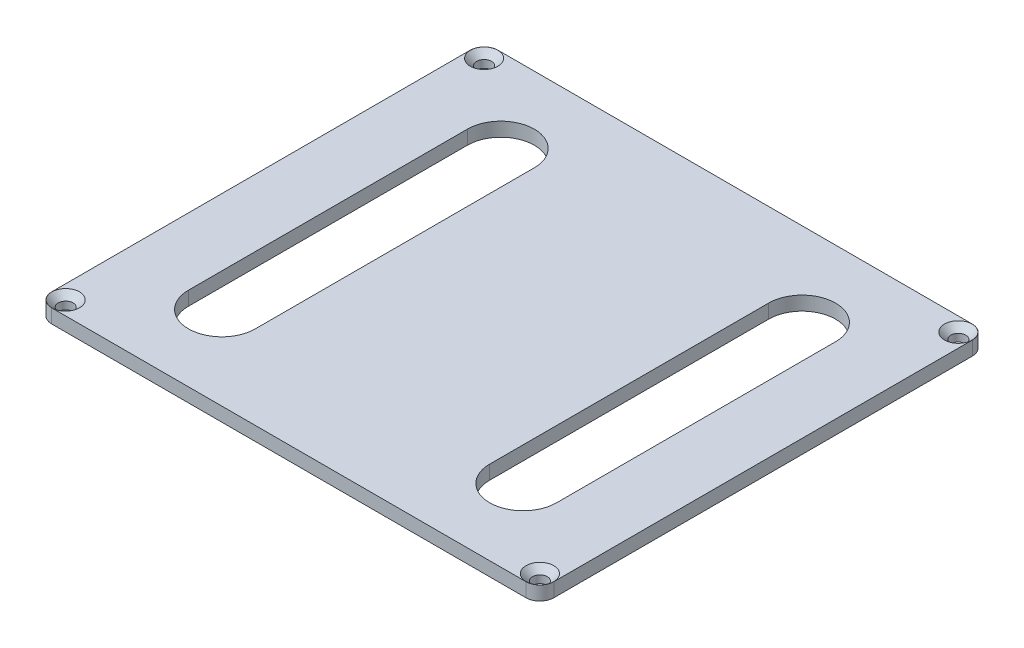
from build123d import *

# Parameters (mm, degrees)
SKETCH1_W                                       = 114.3
SKETCH1_H                                       = 101.6
BOSS_EXTRUDE1_DEPTH                             = 3.175
FILLET1_R                                       = 3.175
CSK_FOR_M3_FLAT_HEAD_MACHINE_SCREW1_D           = 3.4
CSK_FOR_M3_FLAT_HEAD_MACHINE_SCREW1_DEPTH       = 7.874
CSK_FOR_M3_FLAT_HEAD_MACHINE_SCREW1_CSINK_D     = 6.3
CSK_FOR_M3_FLAT_HEAD_MACHINE_SCREW1_CSINK_ANGLE = 90
CSK_FOR_M3_FLAT_HEAD_MACHINE_SCREW1_TIP         = 1.021463052
CUT_EXTRUDE1_DEPTH                              = 77.530014537


with BuildPart() as part:
    # Sketch1 → Boss-Extrude1 (new body)
    with BuildSketch(Plane(origin=(0, 0, 0), x_dir=(1, 0, 0), z_dir=(0, 1, 0))):
        Rectangle(SKETCH1_W, SKETCH1_H)
    extrude(amount=BOSS_EXTRUDE1_DEPTH)

    # Fillet1
    fillet1_edges = [part.edges().sort_by_distance(p)[0] for p in [
        (-57.15, 1.5875, -50.8),
        (57.15, 1.5875, -50.8),
        (57.15, 1.5875, 50.8),
        (-57.15, 1.5875, 50.8),
    ]]
    fillet(fillet1_edges, radius=FILLET1_R)

    # CSK for M3 Flat Head Machine Screw1
    with Locations(Plane(origin=(0, 3.175, 0), x_dir=(1, 0, 0), z_dir=(0, 1, 0))):
        with Locations((53.975, -47.625), (53.975, 47.625), (-53.975, 47.625), (-53.975, -47.625)):
            CounterSinkHole(CSK_FOR_M3_FLAT_HEAD_MACHINE_SCREW1_D / 2, CSK_FOR_M3_FLAT_HEAD_MACHINE_SCREW1_CSINK_D / 2, depth=CSK_FOR_M3_FLAT_HEAD_MACHINE_SCREW1_DEPTH, counter_sink_angle=CSK_FOR_M3_FLAT_HEAD_MACHINE_SCREW1_CSINK_ANGLE)
            with Locations((0, 0, -(CSK_FOR_M3_FLAT_HEAD_MACHINE_SCREW1_DEPTH + CSK_FOR_M3_FLAT_HEAD_MACHINE_SCREW1_TIP / 2))):  # 118° drill point
                Cone(0, CSK_FOR_M3_FLAT_HEAD_MACHINE_SCREW1_D / 2, CSK_FOR_M3_FLAT_HEAD_MACHINE_SCREW1_TIP, mode=Mode.SUBTRACT)

    # Sketch4 → Cut-Extrude1 (cut, through all)
    with BuildSketch(Plane(origin=(0, 3.175, 0), x_dir=(1, 0, 0), z_dir=(0, 1, 0))):
        with BuildLine():
            Line((-41.91, -31.75), (-41.91, 31.75))
            ThreePointArc((-41.91, 31.75), (-34.29, 39.37), (-26.67, 31.75))
            Line((-26.67, 31.75), (-26.67, -31.75))
            ThreePointArc((-26.67, -31.75), (-34.29, -39.37), (-41.91, -31.75))
        make_face()
        with BuildLine():
            Line((41.91, -31.75), (41.91, 31.75))
            ThreePointArc((41.91, 31.75), (34.29, 39.37), (26.67, 31.75))
            Line((26.67, 31.75), (26.67, -31.75))
            ThreePointArc((26.67, -31.75), (34.29, -39.37), (41.91, -31.75))
        make_face()
    extrude(amount=-CUT_EXTRUDE1_DEPTH, mode=Mode.SUBTRACT)


solid = part.part
